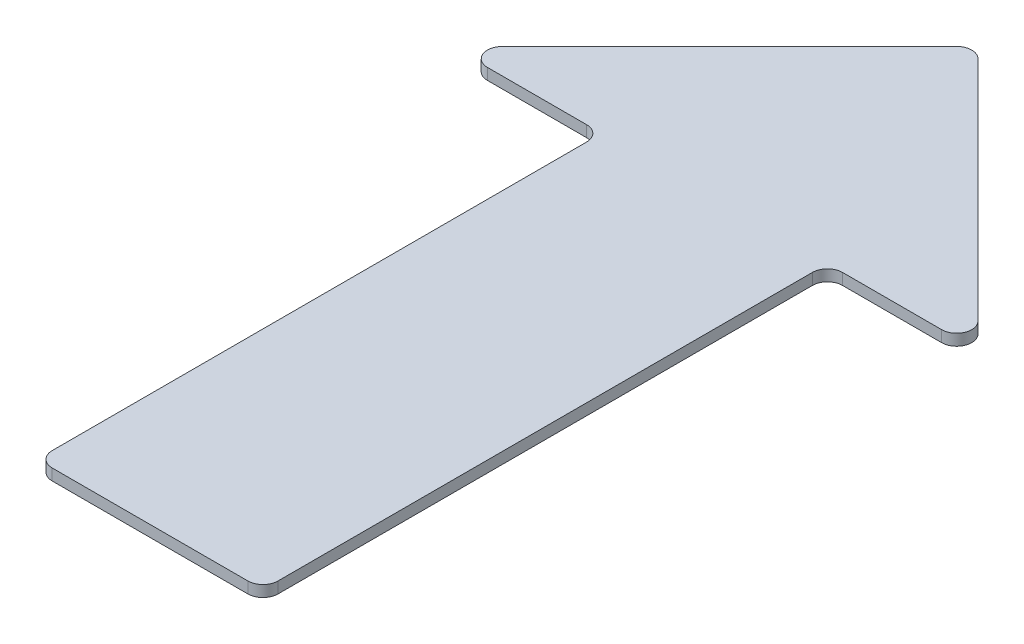
from build123d import *

# Parameters (mm, degrees)
BOSS_EXTRUDE1_DEPTH = 1.5
FILLET1_R           = 2


with BuildPart() as part:
    # Sketch1 → Boss-Extrude1 (new body)
    with BuildSketch(Plane(origin=(0, 0, 0), x_dir=(1, 0, 0), z_dir=(0, 1, 0))):
        Polygon((0, 0), (35, -35), (15, -35), (15, -110), (-15, -110), (-15, -35), (-35, -35), align=None)
    extrude(amount=BOSS_EXTRUDE1_DEPTH)

    # Fillet1
    fillet1_edges = [part.edges().sort_by_distance(p)[0] for p in [
        (0, 0.75, 0),
        (35, 0.75, 35),
        (15, 0.75, 35),
        (15, 0.75, 110),
        (-15, 0.75, 110),
        (-15, 0.75, 35),
        (-35, 0.75, 35),
    ]]
    fillet(fillet1_edges, radius=FILLET1_R)


solid = part.part
